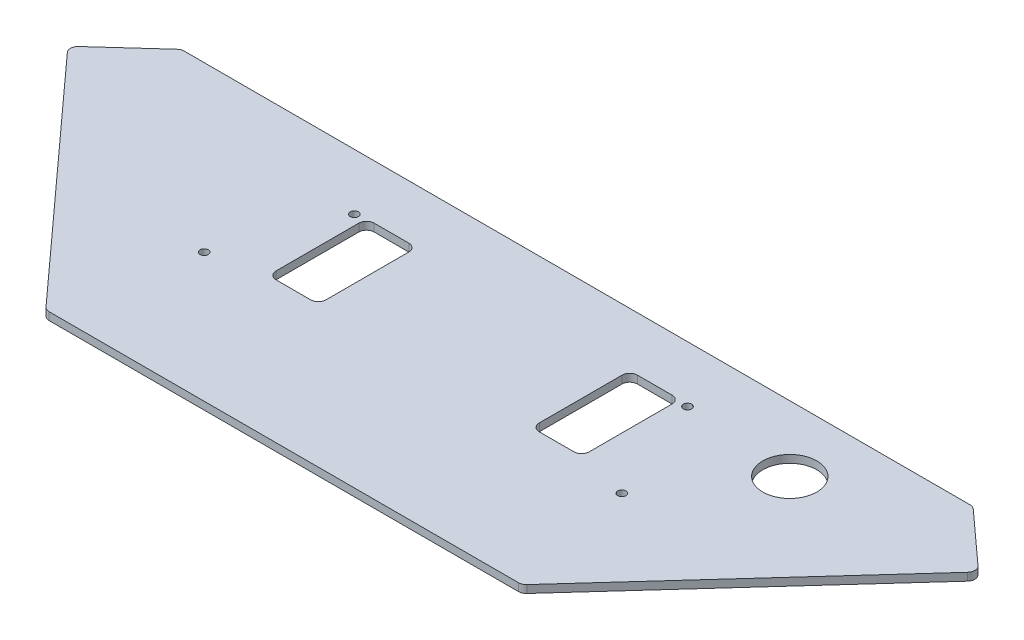
from build123d import *

# Parameters (mm, degrees)
BOSS_EXTRUDE1_DEPTH = 3.175
CUT_EXTRUDE1_DEPTH  = 223.848706048
SKETCH3_R           = 1.7018
CUT_EXTRUDE2_DEPTH  = 3.175
FILLET1_R           = 3.175
SKETCH4_R           = 11.1125
CUT_EXTRUDE3_DEPTH  = 222.748694977


with BuildPart() as part:
    # Sketch1 → Boss-Extrude1 (new body)
    with BuildSketch(Plane(origin=(0, 0, 0), x_dir=(1, 0, 0), z_dir=(0, 1, 0))):
        Polygon((-97.967388467, 0), (97.967388467, 0), (187.33670933, 98.456981239), (162.886958446, 120.65), (-162.886958446, 120.65), (-187.33670933, 98.456981239), align=None)
    extrude(amount=BOSS_EXTRUDE1_DEPTH)

    # Sketch2 → Cut-Extrude1 (cut, through all)
    with BuildSketch(Plane(origin=(0, 3.175, 0), x_dir=(1, 0, 0), z_dir=(0, 1, 0))):
        with BuildLine():
            Line((-61.2648, 58.039), (-47.0408, 58.039))
            ThreePointArc((-47.0408, 58.039), (-44.79573597, 58.96893597), (-43.8658, 61.214))
            Line((-43.8658, 61.214), (-43.8658, 95.25))
            ThreePointArc((-43.8658, 95.25), (-44.79573597, 97.49506403), (-47.0408, 98.425))
            Line((-47.0408, 98.425), (-61.2648, 98.425))
            ThreePointArc((-61.2648, 98.425), (-63.50986403, 97.49506403), (-64.4398, 95.25))
            Line((-64.4398, 95.25), (-64.4398, 61.214))
            ThreePointArc((-64.4398, 61.214), (-63.50986403, 58.96893597), (-61.2648, 58.039))
        make_face()
        with BuildLine():
            Line((43.8658, 61.214), (43.8658, 95.25))
            ThreePointArc((43.8658, 95.25), (44.79573597, 97.49506403), (47.0408, 98.425))
            Line((47.0408, 98.425), (61.2648, 98.425))
            ThreePointArc((61.2648, 98.425), (63.50986403, 97.49506403), (64.4398, 95.25))
            Line((64.4398, 95.25), (64.4398, 61.214))
            ThreePointArc((64.4398, 61.214), (63.50986403, 58.96893597), (61.2648, 58.039))
            Line((61.2648, 58.039), (47.0408, 58.039))
            ThreePointArc((47.0408, 58.039), (44.79573597, 58.96893597), (43.8658, 61.214))
        make_face()
    extrude(amount=-CUT_EXTRUDE1_DEPTH, mode=Mode.SUBTRACT)

    # Sketch3 → Cut-Extrude2 (cut)
    with BuildSketch(Plane(origin=(0, 3.175, 0), x_dir=(1, 0, 0), z_dir=(0, 1, 0))):
        with Locations(Location((68.5292, 97.536, 0), (0, 0, 270))):
            Circle(SKETCH3_R)
        with Locations(Location((85.9282, 53.1114, 0), (0, 0, 270))):
            Circle(SKETCH3_R)
        with Locations(Location((-85.9282, 53.1114, 0), (0, 0, 270))):
            Circle(SKETCH3_R)
        with Locations(Location((-68.5292, 97.536, 0), (0, 0, 270))):
            Circle(SKETCH3_R)
    extrude(amount=-CUT_EXTRUDE2_DEPTH, mode=Mode.SUBTRACT)

    # Fillet1
    fillet1_edges = [part.edges().sort_by_distance(p)[0] for p in [
        (-187.33670933, 1.5875, -98.456981239),
        (-162.886958446, 1.5875, -120.65),
        (162.886958446, 1.5875, -120.65),
        (187.33670933, 1.5875, -98.456981239),
        (97.967388467, 1.5875, 0),
        (-97.967388467, 1.5875, 0),
    ]]
    fillet(fillet1_edges, radius=FILLET1_R)

    # Sketch4 → Cut-Extrude3 (cut, through all)
    with BuildSketch(Plane(origin=(0, 3.175, 0), x_dir=(1, 0, 0), z_dir=(0, 1, 0))):
        with Locations(Location((114.4778, 93.6625, 0), (0, 0, 270))):
            Circle(SKETCH4_R)
    extrude(amount=-CUT_EXTRUDE3_DEPTH, mode=Mode.SUBTRACT)


solid = part.part
